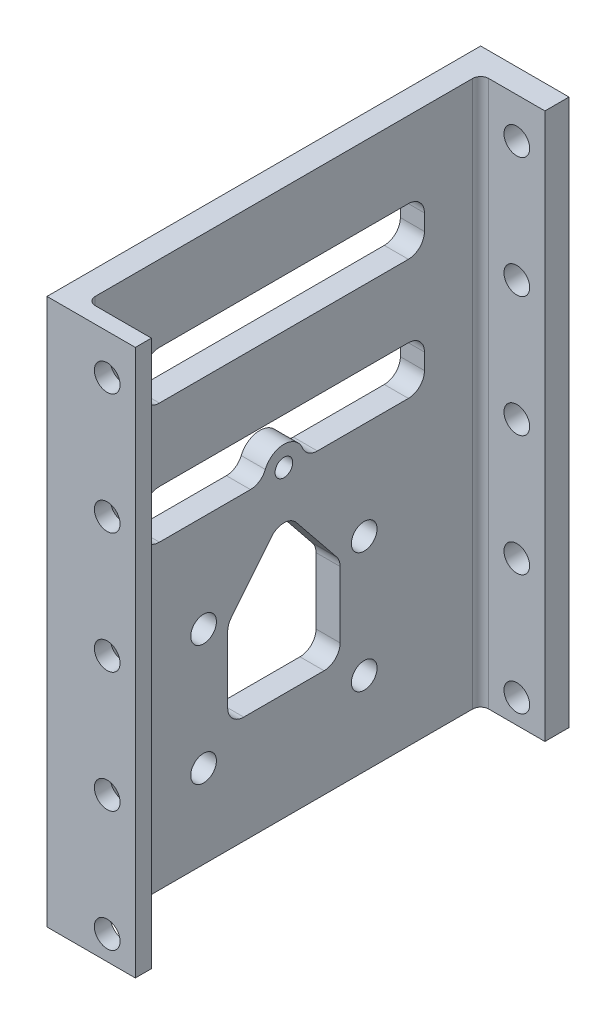
from build123d import *

# Parameters (mm, degrees)
EXTRUDE_1_DEPTH          = 120
SKETCH_2_R               = 1.6
CUT_EXTRUDE_1_DEPTH      = 120
SKETCH_3_R               = 1.6
CUT_EXTRUDE_2_DEPTH      = 10
SKETCH_4_R               = 1.1
CUT_EXTRUDE_3_DEPTH      = 12
SKETCH_5_W               = 11
SKETCH_5_H               = 120
EXTRUDE_2_DEPTH          = 2
SKETCH_6_W               = 49
SKETCH_6_H               = 30
CUT_EXTRUDE_4_DEPTH      = 10
CUT_EXTRUDE_5_DEPTH      = 42
CUT_EXTRUDE_5_DEPTH_BACK = 16
SKETCH_7_W               = 3
SKETCH_7_H               = 30
CUT_EXTRUDE_6_DEPTH      = 35
CUT_EXTRUDE_6_DEPTH_BACK = 11
SKETCH_8_W               = 52
SKETCH_8_H               = 12
SKETCH_9_W               = 2
SKETCH_9_H               = 42
CUT_EXTRUDE_7_DEPTH      = 20
SKETCH_10_W              = 11
SKETCH_10_H              = 54
CUT_EXTRUDE_8_DEPTH      = 10
SKETCH_11_W              = 11
SKETCH_11_H              = 68
SKETCH_11_R              = 1.6
EXTRUDE_3_DEPTH          = 1
SKETCH_12_W              = 11
SKETCH_12_H              = 1
CUT_EXTRUDE_9_DEPTH      = 91
CUT_EXTRUDE_10_DEPTH     = 10
SKETCH_14_W              = 35
SKETCH_14_H              = 6
CUT_EXTRUDE_11_DEPTH     = 10
FILLET_1_R               = 2
FILLET_2_R               = 1


with BuildPart() as part:
    # 草图1 → 凸台-拉伸1 (new body)
    with BuildSketch(Plane(origin=(0, 0, 0), x_dir=(1, 0, 0), z_dir=(0, 1, 0))):
        Polygon((0, 0), (8, 0), (8, -3), (-3, -3), (-3, 49), (0, 49), align=None)
    extrude(amount=EXTRUDE_1_DEPTH)

    # 草图2 → 切除-拉伸1 (cut)
    with BuildSketch(Plane(origin=(0, 0, 0), x_dir=(-1, 0, 0), z_dir=(0, 0, -1))):
        with Locations((-4.5, 60)):
            Circle(SKETCH_2_R)
        with Locations((-4.5, 45)):
            Circle(SKETCH_2_R)
        with Locations((-4.5, 30)):
            Circle(SKETCH_2_R)
        with Locations((-4.5, 15)):
            Circle(SKETCH_2_R)
        with Locations((-4.5, 75)):
            Circle(SKETCH_2_R)
        with Locations((-4.5, 90)):
            Circle(SKETCH_2_R)
        with Locations((-4.5, 105)):
            Circle(SKETCH_2_R)
    cut_extrude_1 = extrude(amount=-CUT_EXTRUDE_1_DEPTH, mode=Mode.SUBTRACT)

    # 草图3 → 切除-拉伸2 (cut)
    with BuildSketch(Plane(origin=(0, 0, 0), x_dir=(0, 0, -1), z_dir=(1, 0, 0))):
        with Locations((14.5, 7.384470662)):
            Circle(SKETCH_3_R)
        with Locations((14.5, 22.384470662)):
            Circle(SKETCH_3_R)
        with Locations((14.5, 37.384470662)):
            Circle(SKETCH_3_R)
        with Locations((14.5, 52.384470662)):
            Circle(SKETCH_3_R)
        with Locations((14.5, 67.384470662)):
            Circle(SKETCH_3_R)
        with Locations((34.5, 67.384470662)):
            Circle(SKETCH_3_R)
        with Locations((34.5, 52.384470662)):
            Circle(SKETCH_3_R)
        with Locations((34.5, 37.384470662)):
            Circle(SKETCH_3_R)
        with Locations((34.5, 22.384470662)):
            Circle(SKETCH_3_R)
        with Locations((34.5, 7.384470662)):
            Circle(SKETCH_3_R)
    extrude(amount=-CUT_EXTRUDE_2_DEPTH, mode=Mode.SUBTRACT)

    # 草图4 → 切除-拉伸3 (cut)
    with BuildSketch(Plane(origin=(0, 0, 0), x_dir=(0, 0, -1), z_dir=(1, 0, 0))):
        with Locations((15.7, 117)):
            Circle(SKETCH_4_R)
        with Locations((33.3, 117)):
            Circle(SKETCH_4_R)
        with Locations((24.5, 79.8)):
            Circle(SKETCH_4_R)
    extrude(amount=-CUT_EXTRUDE_3_DEPTH, mode=Mode.SUBTRACT)

    # 草图5 → 凸台-拉伸2 (add)
    with BuildSketch(Plane(origin=(0, 0, -49), x_dir=(-1, 0, 0), z_dir=(0, 0, -1))):
        with Locations((-2.5, 60)):
            Rectangle(SKETCH_5_W, SKETCH_5_H)
    extrude(amount=EXTRUDE_2_DEPTH)

    # 镜向3: 切除-拉伸1 across plane
    add(cut_extrude_1.mirror(Plane(origin=(0, 0, -24.5), x_dir=(1, 0, 0), z_dir=(0, 0, -1))), mode=Mode.SUBTRACT)

    # 草图6 → 切除-拉伸4 (cut)
    with BuildSketch(Plane(origin=(0, 0, 0), x_dir=(0, 0, -1), z_dir=(1, 0, 0))):
        with Locations((24.5, 15)):
            Rectangle(SKETCH_6_W, SKETCH_6_H)
    extrude(amount=-CUT_EXTRUDE_4_DEPTH, mode=Mode.SUBTRACT)

    # 草图7 → 切除-拉伸5 (cut, two sides: drawn at the far end of the back side and taken through both)
    with BuildSketch(Plane(origin=(0, 0, 0), x_dir=(0, 0, -1), z_dir=(1, 0, 0)).offset(-CUT_EXTRUDE_5_DEPTH_BACK)):
        with Locations((-1.5, 15)):
            Rectangle(SKETCH_7_W, SKETCH_7_H)
    extrude(amount=CUT_EXTRUDE_5_DEPTH + CUT_EXTRUDE_5_DEPTH_BACK, mode=Mode.SUBTRACT)

    # 草图8 → 切除-拉伸6 (cut, two sides: drawn at the far end of the back side and taken through both)
    with BuildSketch(Plane(origin=(0, 0, 0), x_dir=(0, 0, -1), z_dir=(1, 0, 0)).offset(-CUT_EXTRUDE_6_DEPTH_BACK)):
        with Locations((23, 36)):
            Rectangle(SKETCH_8_W, SKETCH_8_H)
    extrude(amount=CUT_EXTRUDE_6_DEPTH + CUT_EXTRUDE_6_DEPTH_BACK, mode=Mode.SUBTRACT)

    # 草图9 → 切除-拉伸7 (cut)
    with BuildSketch(Plane.ZY.offset(3)):
        with Locations((-50, 21)):
            Rectangle(SKETCH_9_W, SKETCH_9_H)
    extrude(amount=-CUT_EXTRUDE_7_DEPTH, mode=Mode.SUBTRACT)

    # 草图10 → 切除-拉伸8 (cut)
    with BuildSketch(Plane(origin=(0, 120, 0), x_dir=(1, 0, 0), z_dir=(0, 1, 0))):
        with Locations((2.5, 24)):
            Rectangle(SKETCH_10_W, SKETCH_10_H)
    extrude(amount=-CUT_EXTRUDE_8_DEPTH, mode=Mode.SUBTRACT)

    # 草图11 → 凸台-拉伸3 (add)
    with BuildSketch(Plane(origin=(0, 0, -51), x_dir=(-1, 0, 0), z_dir=(0, 0, -1))):
        with Locations((-2.5, 76)):
            Rectangle(SKETCH_11_W, SKETCH_11_H)
        with Locations((-4.5, 105)):
            Circle(SKETCH_11_R, mode=Mode.SUBTRACT)
        with Locations((-4.5, 45)):
            Circle(SKETCH_11_R, mode=Mode.SUBTRACT)
        with Locations((-4.5, 60)):
            Circle(SKETCH_11_R, mode=Mode.SUBTRACT)
        with Locations((-4.5, 75)):
            Circle(SKETCH_11_R, mode=Mode.SUBTRACT)
        with Locations((-4.5, 90)):
            Circle(SKETCH_11_R, mode=Mode.SUBTRACT)
    extrude(amount=EXTRUDE_3_DEPTH)

    # 草图12 → 切除-拉伸9 (cut)
    with BuildSketch(Plane(origin=(0, 110, 0), x_dir=(1, 0, 0), z_dir=(0, 1, 0))):
        with Locations((2.5, -2.5)):
            Rectangle(SKETCH_12_W, SKETCH_12_H)
    extrude(amount=-CUT_EXTRUDE_9_DEPTH, mode=Mode.SUBTRACT)

    # 草图13 → 切除-拉伸10 (cut)
    with BuildSketch(Plane.ZY.offset(3)):
        Polygon((-31.5, 66.326548237), (-24.5, 75.017418774), (-17.5, 66.326548237), (-17.5, 55.384470662), (-31.5, 55.384470662), align=None)
    extrude(amount=-CUT_EXTRUDE_10_DEPTH, mode=Mode.SUBTRACT)

    # 草图14 → 切除-拉伸11 (cut)
    with BuildSketch(Plane.ZY.offset(3)):
        with Locations((-24.5, 97.5)):
            Rectangle(SKETCH_14_W, SKETCH_14_H)
        with BuildLine():
            Line((-22.018065271, 79.5), (-7, 79.5))
            Line((-7, 79.5), (-7, 85.5))
            Line((-7, 85.5), (-42, 85.5))
            Line((-42, 85.5), (-42, 79.5))
            Line((-42, 79.5), (-26.981934729, 79.5))
            ThreePointArc((-26.981934729, 79.5), (-24.5, 82.3), (-22.018065271, 79.5))
        make_face()
    extrude(amount=-CUT_EXTRUDE_11_DEPTH, mode=Mode.SUBTRACT)

    # 圆角1
    fillet_1_edges = [part.edges().sort_by_distance(p)[0] for p in [
        (-1.5, 55.384470662, -31.5),
        (-1.5, 66.326548237, -31.5),
        (-1.5, 75.017418774, -24.5),
        (-1.5, 66.326548237, -17.5),
        (-1.5, 55.384470662, -17.5),
        (-1.5, 100.5, -7),
        (-1.5, 94.5, -7),
        (-1.5, 94.5, -42),
        (-1.5, 100.5, -42),
        (-1.5, 85.5, -7),
        (-1.5, 79.5, -7),
        (-1.5, 79.5, -22.018065271),
        (-1.5, 79.5, -26.981934729),
        (-1.5, 79.5, -42),
        (-1.5, 85.5, -42),
    ]]
    fillet(fillet_1_edges, radius=FILLET_1_R)

    # 圆角2
    fillet_2_edges = [part.edges().sort_by_distance(p)[0] for p in [
        (0, 76, -49),
        (0, 76, 0),
    ]]
    fillet(fillet_2_edges, radius=FILLET_2_R)


solid = part.part
